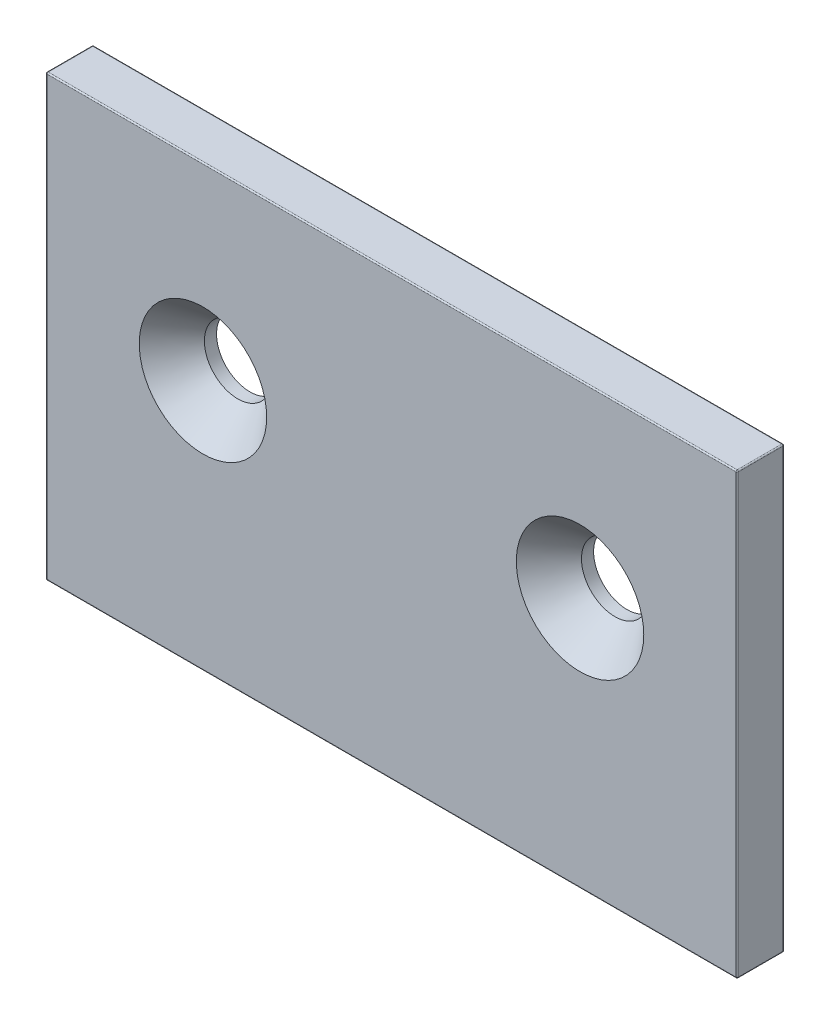
from build123d import *

# Parameters (mm, degrees)
SKETCH1_W                                     = 69.85
SKETCH1_H                                     = 44.45
BOSS_EXTRUDE1_DEPTH                           = 4.7498
CSK_FOR_1_4_FLAT_HEAD_MACHINE_SCREW1_AT_COUNT = 2
CSK_FOR_1_4_FLAT_HEAD_MACHINE_SCREW1_AT_PITCH = 38.1
FILLET1_R                                     = 0.127


with BuildPart() as part:
    # Sketch1 → Boss-Extrude1 (new body)
    with BuildSketch(Plane.XY):
        with Locations((0, 22.225)):
            Rectangle(SKETCH1_W, SKETCH1_H)
    extrude(amount=-BOSS_EXTRUDE1_DEPTH)

    # Sketch3 → CSK for 1/4 Flat Head Machine Screw1 (revolve, cut)
    with BuildSketch(Plane(origin=(19.05, 25.4, 0), x_dir=(0, -1, 0), z_dir=(1, 0, 0))):
        Polygon((0, 0), (0, 4.7498), (3.3782, 4.7498), (3.3782, 3.520932584), (6.4389, 0), align=None)
    csk_for_1_4_flat_head_machine_screw1 = revolve(axis=Axis((19.05, 25.4, 6.35), (0, 0, -1)), mode=Mode.SUBTRACT)

    # CSK for 1/4 Flat Head Machine Screw1 at: CSK for 1/4 Flat Head Machine Screw1 ×2
    with Locations(*[(-i * CSK_FOR_1_4_FLAT_HEAD_MACHINE_SCREW1_AT_PITCH, 0, 0) for i in range(1, CSK_FOR_1_4_FLAT_HEAD_MACHINE_SCREW1_AT_COUNT)]):
        add(csk_for_1_4_flat_head_machine_screw1, mode=Mode.SUBTRACT)

    # Fillet1
    fillet1_edges = [part.edges().sort_by_distance(p)[0] for p in [
        (34.925, 22.225, -4.7498),
        (0, 44.45, -4.7498),
        (-34.925, 22.225, -4.7498),
        (0, 44.45, 0),
        (34.925, 22.225, 0),
        (0, 0, 0),
        (-34.925, 22.225, 0),
        (-34.925, 44.45, -2.3749),
        (34.925, 44.45, -2.3749),
        (34.925, 0, -2.3749),
        (-34.925, 0, -2.3749),
        (0, 0, -4.7498),
    ]]
    fillet(fillet1_edges, radius=FILLET1_R)


solid = part.part
